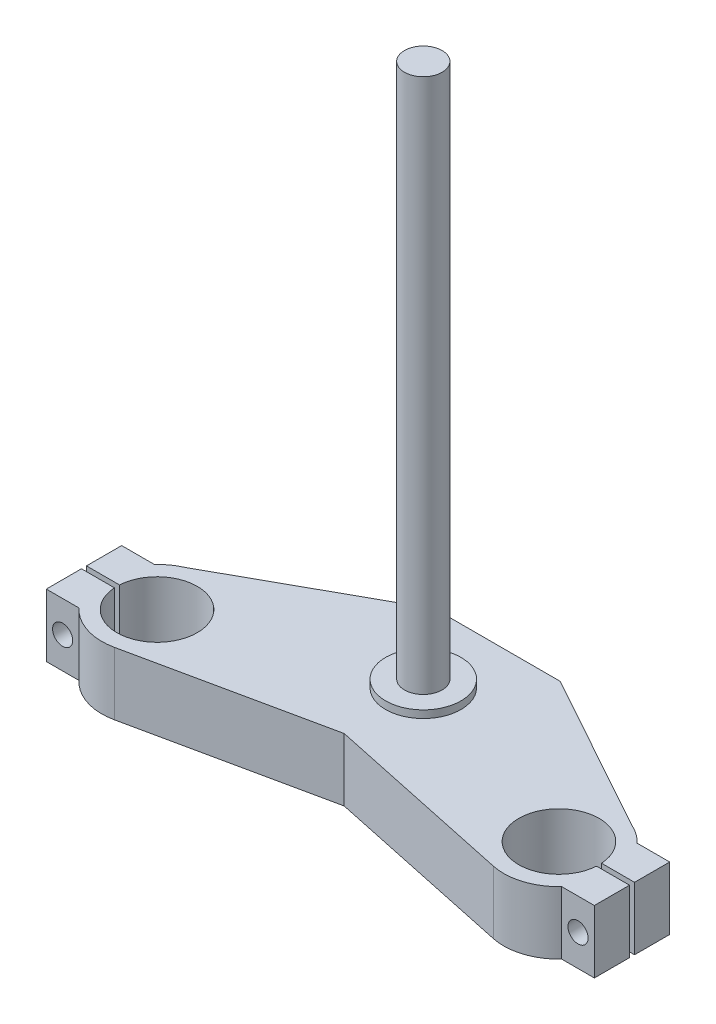
from build123d import *

# Parameters (mm, degrees)
BOSS_EXTRUDE1_DEPTH = 25
SKETCH3_R           = 4
CUT_EXTRUDE1_DEPTH  = 15
SKETCH4_R           = 15
BOSS_EXTRUDE2_DEPTH = 3
SKETCH5_R           = 7.5
BOSS_EXTRUDE3_DEPTH = 213


with BuildPart() as part:
    # Sketch1 → Boss-Extrude1 (new body)
    with BuildSketch(Plane(origin=(0, 0, 0), x_dir=(1, 0, 0), z_dir=(0, 1, 0))):
        with BuildLine():
            Line((-25, 55.5), (-88.782047704, 20.180509757))
            ThreePointArc((-88.782047704, 20.180509757), (-92.710355788, 17.967308971), (-96.105195929, 15))
            Line((-96.105195929, 15), (-109.105195929, 15))
            Line((-109.105195929, 15), (-109.105195929, 1))
            Line((-109.105195929, 1), (-95.968719423, 1))
            ThreePointArc((-95.968719423, 1), (-64, 0), (-95.968719423, -1))
            Line((-95.968719423, -1), (-109.105195929, -1))
            Line((-109.105195929, -1), (-109.105195929, -15))
            Line((-109.105195929, -15), (-96.105195929, -15))
            ThreePointArc((-96.105195929, -15), (-86.625068957, -20.987753506), (-75.425325161, -21.527881597))
            Line((-75.425325161, -21.527881597), (0, -5.5))
            Line((0, -5.5), (75.425325161, -21.527881597))
            ThreePointArc((75.425325161, -21.527881597), (86.625068957, -20.987753506), (96.105195929, -15))
            Line((96.105195929, -15), (109.105195929, -15))
            Line((109.105195929, -15), (109.105195929, -1))
            Line((109.105195929, -1), (95.968719423, -1))
            ThreePointArc((95.968719423, -1), (64, 0), (95.968719423, 1))
            Line((95.968719423, 1), (109.105195929, 1))
            Line((109.105195929, 1), (109.105195929, 15))
            Line((109.105195929, 15), (96.105195929, 15))
            ThreePointArc((96.105195929, 15), (92.710355788, 17.967308971), (88.782047704, 20.180509757))
            Line((88.782047704, 20.180509757), (25, 55.5))
            Line((25, 55.5), (1, 55.5))
            Line((1, 55.5), (-1, 55.5))
            Line((-1, 55.5), (-25, 55.5))
        make_face()
    extrude(amount=BOSS_EXTRUDE1_DEPTH)

    # Sketch3 → Cut-Extrude1 (cut, symmetric)
    with BuildSketch(Plane.XY):
        with Locations((-102.605195929, 12.5)):
            Circle(SKETCH3_R)
        with Locations(Location((102.605195929, 12.5, 0), (0, 0, 180))):
            Circle(SKETCH3_R)
    extrude(amount=CUT_EXTRUDE1_DEPTH, both=True, mode=Mode.SUBTRACT)

    # Sketch4 → Boss-Extrude2 (add)
    with BuildSketch(Plane(origin=(0, 25, 0), x_dir=(1, 0, 0), z_dir=(0, 1, 0))):
        with Locations(Location((0, 26, 0), (0, 0, 270))):
            Circle(SKETCH4_R)
    extrude(amount=BOSS_EXTRUDE2_DEPTH)

    # Sketch5 → Boss-Extrude3 (add)
    with BuildSketch(Plane(origin=(0, 28, 0), x_dir=(1, 0, 0), z_dir=(0, 1, 0))):
        with Locations(Location((0, 26, 0), (0, 0, 270))):
            Circle(SKETCH5_R)
    extrude(amount=BOSS_EXTRUDE3_DEPTH)


solid = part.part
